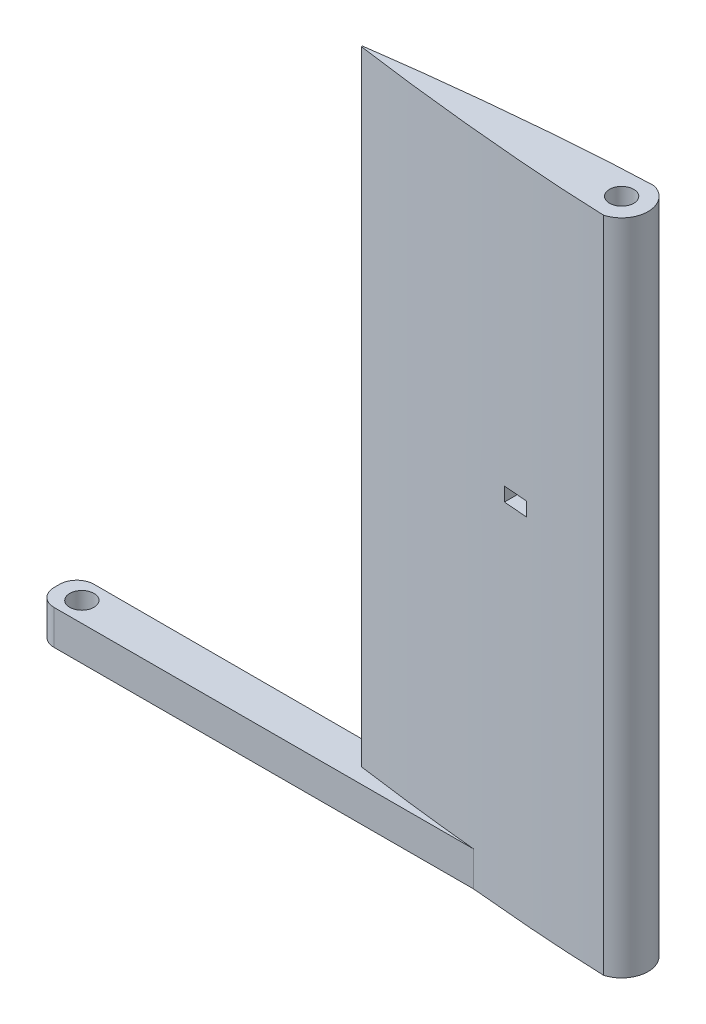
from build123d import *

# Parameters (mm, degrees)
SKETCH1_R           = 1.778
BOSS_EXTRUDE1_DEPTH = 96.52
SKETCH2_W           = 5.588
SKETCH2_H           = 2.032
CUT_EXTRUDE1_DEPTH  = 3.048
BOSS_EXTRUDE4_DEPTH = 5.08
SKETCH7_R           = 1.778
CUT_EXTRUDE2_DEPTH  = 5.08
FILLET1_R           = 2.54


with BuildPart() as part:
    # Sketch1 → Boss-Extrude1 (new body)
    with BuildSketch(Plane(origin=(0, 0, 0), x_dir=(1, 0, 0), z_dir=(0, 1, 0))):
        with BuildLine():
            Line((-22.300033558, 0.421731993), (-22.300033558, 0.581751993))
            add(Edge.make_bspline(
                [(-22.300033558, 0.581751993), (-21.241941414, 0.727701793), (-19.126856353, 1.01944977), (-15.951376845, 1.424429686), (-12.776341364, 1.809105283), (-9.601168328, 2.170624627), (-6.426111922, 2.511711497), (-3.251098671, 2.831902905), (-0.076148645, 3.130340148), (3.098918671, 3.403326924), (6.273871033, 3.651308872), (9.470064679, 3.869981778), (12.666162626, 4.057112429), (15.139925914, 4.164340231), (16.533881684, 4.214568226), (16.869130939, 4.225691153)],
                knots=[0, 0, 0, 0, 0.024634231, 0.04924287, 0.07382978, 0.098396751, 0.122945996, 0.147478562, 0.171994581, 0.196493552, 0.220976186, 0.245442093, 0.270380478, 0.294812969, 0.302548899, 0.302548899, 0.302548899, 0.302548899], degree=3))
            ThreePointArc((16.869130939, 4.225691153), (19.66431815, 0.501741993), (16.869130939, -3.222207168))
            add(Edge.make_bspline(
                [(16.869130939, -3.222207168), (16.533881684, -3.21108424), (15.139925914, -3.160856245), (12.666162626, -3.053628443), (9.470064679, -2.866497792), (6.273871033, -2.647824886), (3.098918671, -2.399842938), (-0.076148645, -2.126856163), (-3.251098671, -1.82841892), (-6.426111922, -1.508227511), (-9.601168328, -1.167140642), (-12.776341364, -0.805621298), (-15.951376845, -0.420945701), (-19.126856353, -0.015965784), (-21.241941414, 0.275782192), (-22.300033558, 0.421731993)],
                knots=[0.697451101, 0.697451101, 0.697451101, 0.697451101, 0.705187031, 0.729619522, 0.754557907, 0.779023814, 0.803506448, 0.828005419, 0.852521438, 0.877054004, 0.901603249, 0.92617022, 0.95075713, 0.975365769, 1, 1, 1, 1], degree=3))
        make_face()
        with Locations(Location((15.786068277, 0.501741993, 0), (0, 0, 90))):
            Circle(SKETCH1_R, mode=Mode.SUBTRACT)
    extrude(amount=BOSS_EXTRUDE1_DEPTH)

    # Sketch2 → Cut-Extrude1 (cut)
    with BuildSketch(Plane.XY.offset(2.54)):
        with Locations((4.151336485, 52.87147878)):
            Rectangle(SKETCH2_W, SKETCH2_H)
    extrude(amount=-CUT_EXTRUDE1_DEPTH, mode=Mode.SUBTRACT)

    # Sketch3 → Boss-Extrude4 (add)
    with BuildSketch(Plane(origin=(0, 0, 0), x_dir=(-1, 0, 0), z_dir=(0, -1, 0))):
        with BuildLine():
            add(Edge.make_bspline(
                [(10.650355893, 2.050005208), (11.358767299, 1.970085754), (13.126070598, 1.766733378), (15.173174827, 1.518713775), (16.511893664, 1.35112125), (16.792774705, 1.315680774)],
                knots=[0.212277068, 0.212277068, 0.212277068, 0.212277068, 0.228719118, 0.253306028, 0.259835455, 0.259835455, 0.259835455, 0.259835455], degree=3))
            Line((16.792774705, 1.315680774), (16.792774705, 3.995440037))
            Line((16.792774705, 3.995440037), (6.014233657, 2.550945433))
            add(Edge.make_bspline(
                [(6.014233657, 2.550945433), (6.151172956, 2.53680216), (7.346849115, 2.412799437), (8.892338702, 2.246772086), (10.300290918, 2.089497799), (10.650355893, 2.050005208)],
                knots=[0.176427807, 0.176427807, 0.176427807, 0.176427807, 0.179602902, 0.204152148, 0.212277068, 0.212277068, 0.212277068, 0.212277068], degree=3))
        make_face()
        with BuildLine():
            Line((16.792774705, 3.995440037), (16.792774705, 1.315680774))
            add(Edge.make_bspline(
                [(16.792774705, 1.315680774), (17.570501205, 1.217550273), (19.407308985, 0.980765043), (21.241941414, 0.727701793), (22.300033558, 0.581751993)],
                knots=[0.259835455, 0.259835455, 0.259835455, 0.259835455, 0.277914667, 0.302548899, 0.302548899, 0.302548899, 0.302548899], degree=3))
            Line((22.300033558, 0.581751993), (67.592774705, 0.581751993))
            Line((67.592774705, 0.581751993), (67.592774705, 3.995440037))
            Line((67.592774705, 3.995440037), (16.792774705, 3.995440037))
        make_face()
        with BuildLine():
            Line((67.592774705, 0.581751993), (22.300033558, 0.581751993))
            Line((22.300033558, 0.581751993), (22.300033558, 0.421731993))
            add(Edge.make_bspline(
                [(22.300033558, 0.421731993), (21.241941414, 0.275782192), (19.126856353, -0.015965784), (15.951376845, -0.420945701), (12.776341364, -0.805621298), (9.601168328, -1.167140642), (6.552887523, -1.494608385), (4.562438812, -1.696123873), (3.630729661, -1.787654474)],
                knots=[0.697451101, 0.697451101, 0.697451101, 0.697451101, 0.722085333, 0.746693972, 0.771280882, 0.795847852, 0.820397098, 0.841988969, 0.841988969, 0.841988969, 0.841988969], degree=3))
            Line((3.630729661, -1.787654474), (67.592774705, -1.879270853))
            Line((67.592774705, -1.879270853), (67.592774705, 0.581751993))
        make_face()
    extrude(amount=-BOSS_EXTRUDE4_DEPTH)

    # Sketch7 → Cut-Extrude2 (cut)
    with BuildSketch(Plane(origin=(0, 0, 0), x_dir=(-1, 0, 0), z_dir=(0, -1, 0))):
        with Locations(Location((63.916722706, 1.058084592, 0), (0, 0, 90))):
            Circle(SKETCH7_R)
    extrude(amount=-CUT_EXTRUDE2_DEPTH, mode=Mode.SUBTRACT)

    # Fillet1
    fillet1_edges = [part.edges().sort_by_distance(p)[0] for p in [
        (-67.592774705, 2.54, -3.995440037),
        (-67.592774705, 2.54, 1.879270853),
    ]]
    fillet(fillet1_edges, radius=FILLET1_R)


solid = part.part
